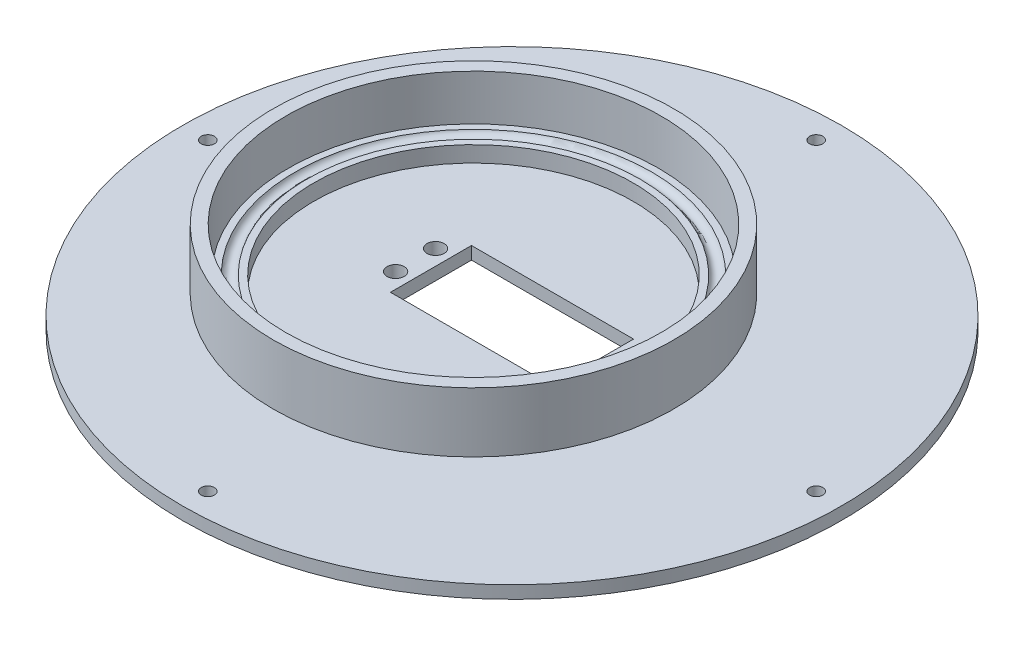
from build123d import *

# Parameters (mm, degrees)
SKETCH1_R           = 82.55
BOSS_EXTRUDE1_DEPTH = 3.175
SKETCH2_R           = 2.15
SKETCH2_W           = 40.6
SKETCH2_H           = 20.3
CUT_EXTRUDE1_DEPTH  = 3.175
SKETCH3_R           = 1.65
CUT_EXTRUDE2_DEPTH  = 3.175
CIRPATTERN1_COUNT   = 4
SKETCH4_R           = 46.35
SKETCH4_R_2         = 40
BOSS_EXTRUDE2_DEPTH = 4
SKETCH7_R           = 1.5875
SKETCH8_R           = 50.175
SKETCH8_R_2         = 47
BOSS_EXTRUDE3_DEPTH = 15


with BuildPart() as part:
    # Sketch1 → Boss-Extrude1 (new body)
    with BuildSketch(Plane(origin=(0, 0, 0), x_dir=(1, 0, 0), z_dir=(0, 1, 0))):
        with Locations(Location((0, 0, 0), (0, 0, 270))):
            Circle(SKETCH1_R)
    extrude(amount=BOSS_EXTRUDE1_DEPTH)

    # Sketch2 → Cut-Extrude1 (cut)
    with BuildSketch(Plane(origin=(0, 3.175, 0), x_dir=(1, 0, 0), z_dir=(0, 1, 0))):
        with Locations(Location((-24.15, 5, 0), (0, 0, 270))):
            Circle(SKETCH2_R)
        with Locations(Location((-24.15, -5, 0), (0, 0, 270))):
            Circle(SKETCH2_R)
        with Locations(Location((24.15, 5, 0), (0, 0, 270))):
            Circle(SKETCH2_R)
        with Locations(Location((24.15, -5, 0), (0, 0, 270))):
            Circle(SKETCH2_R)
        Rectangle(SKETCH2_W, SKETCH2_H)
    extrude(amount=-CUT_EXTRUDE1_DEPTH, mode=Mode.SUBTRACT)

    # Sketch3 → Cut-Extrude2 (cut)
    with BuildSketch(Plane(origin=(0, 3.175, 0), x_dir=(1, 0, 0), z_dir=(0, 1, 0))):
        with Locations(Location((-76.2, 0, 0), (0, 0, 270))):
            Circle(SKETCH3_R)
    cut_extrude2 = extrude(amount=-CUT_EXTRUDE2_DEPTH, mode=Mode.SUBTRACT)

    # CirPattern1: Cut-Extrude2 ×4 about axis
    cirpattern1_axis = Axis((0, 0, 0), (0, 1, 0))
    for i in range(1, CIRPATTERN1_COUNT):
        add(cut_extrude2.rotate(cirpattern1_axis, i * 360 / CIRPATTERN1_COUNT), mode=Mode.SUBTRACT)

    # Sketch4 → Boss-Extrude2 (add)
    with BuildSketch(Plane(origin=(0, 3.175, 0), x_dir=(1, 0, 0), z_dir=(0, 1, 0))):
        with Locations(Location((-9.65, 0, 0), (0, 0, 270))):
            Circle(SKETCH4_R)
        with Locations(Location((-9.65, 0, 0), (0, 0, 270))):
            Circle(SKETCH4_R_2, mode=Mode.SUBTRACT)
    extrude(amount=BOSS_EXTRUDE2_DEPTH)

    # Sketch7 → Cut-Revolve1 (revolve, cut)
    with BuildSketch(Plane.XY, mode=Mode.PRIVATE) as cut_revolve1_sk:
        with Locations((-52.825, 7.675)):
            Circle(SKETCH7_R)
    revolve(cut_revolve1_sk.sketch.rotate(Axis((-9.65, 3.175, 0), (0, 1, 0)), 270), axis=Axis((-9.65, 3.175, 0), (0, 1, 0)), mode=Mode.SUBTRACT)

    # Sketch8 → Boss-Extrude3 (add)
    with BuildSketch(Plane(origin=(0, 3.175, 0), x_dir=(1, 0, 0), z_dir=(0, 1, 0))):
        with Locations(Location((-9.65, 0, 0), (0, 0, 270))):
            Circle(SKETCH8_R)
        with Locations(Location((-9.65, 0, 0), (0, 0, 270))):
            Circle(SKETCH8_R_2, mode=Mode.SUBTRACT)
    extrude(amount=BOSS_EXTRUDE3_DEPTH)


solid = part.part
